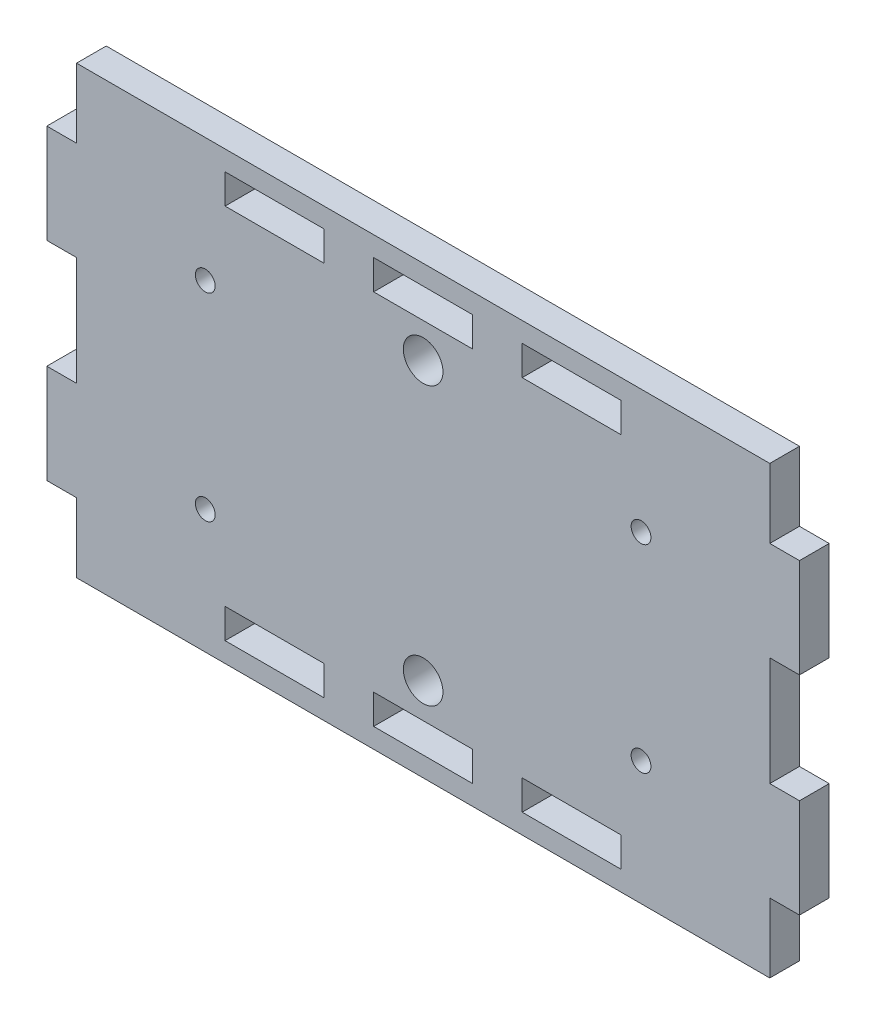
from build123d import *

# Parameters (mm, degrees)
SKETCH_1_R      = 2
SKETCH_1_R_2    = 1
SKETCH_1_W      = 10
SKETCH_1_H      = 3
EXTRUDE_1_DEPTH = 3


with BuildPart() as part:
    # 草图1 → 凸台-拉伸1 (new body)
    with BuildSketch(Plane.XY):
        Polygon((-35, 17.5), (-35, 15.5), (-38, 15.5), (-38, 5.5), (-35, 5.5), (-35, -5.5), (-38, -5.5), (-38, -15.5), (-35, -15.5), (-35, -17.5), (-35, -22.5), (35, -22.5), (35, -17.5), (35, -15.5), (38, -15.5), (38, -5.5), (35, -5.5), (35, 5.5), (38, 5.5), (38, 15.5), (35, 15.5), (35, 17.5), (35, 22.5), (-35, 22.5), align=None)
        with Locations((0, 14)):
            Circle(SKETCH_1_R, mode=Mode.SUBTRACT)
        with Locations(Location((0, -14, 0), (0, 0, 180))):
            Circle(SKETCH_1_R, mode=Mode.SUBTRACT)
        with Locations((22, 10)):
            Circle(SKETCH_1_R_2, mode=Mode.SUBTRACT)
        with Locations((22, -10)):
            Circle(SKETCH_1_R_2, mode=Mode.SUBTRACT)
        with Locations((-22, -10)):
            Circle(SKETCH_1_R_2, mode=Mode.SUBTRACT)
        with Locations((-22, 10)):
            Circle(SKETCH_1_R_2, mode=Mode.SUBTRACT)
        with Locations((0, 19)):
            Rectangle(SKETCH_1_W, SKETCH_1_H, mode=Mode.SUBTRACT)
        with Locations((-15, 19)):
            Rectangle(SKETCH_1_W, SKETCH_1_H, mode=Mode.SUBTRACT)
        with Locations((15, 19)):
            Rectangle(SKETCH_1_W, SKETCH_1_H, mode=Mode.SUBTRACT)
        with Locations((15, -19)):
            Rectangle(SKETCH_1_W, SKETCH_1_H, mode=Mode.SUBTRACT)
        with Locations((0, -19)):
            Rectangle(SKETCH_1_W, SKETCH_1_H, mode=Mode.SUBTRACT)
        with Locations((-15, -19)):
            Rectangle(SKETCH_1_W, SKETCH_1_H, mode=Mode.SUBTRACT)
    extrude(amount=EXTRUDE_1_DEPTH)


solid = part.part
